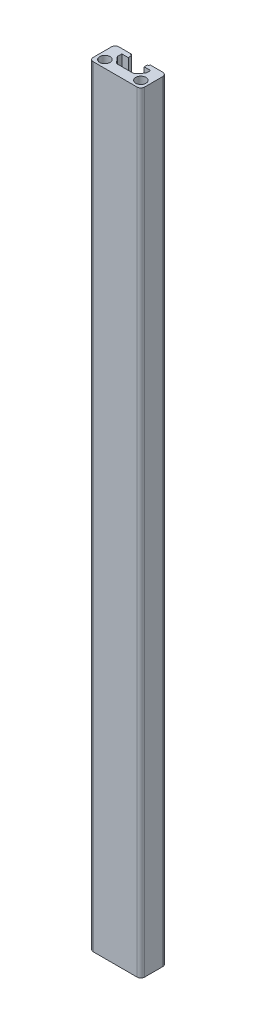
from build123d import *

# Parameters (mm, degrees)
SKETCH_1_R      = 2
EXTRUDE_1_DEPTH = 300
FILLET_1_R      = 1.5


with BuildPart() as part:
    # 草图1 → 凸台-拉伸1 (new body)
    with BuildSketch(Plane(origin=(0, 0, 0), x_dir=(1, 0, 0), z_dir=(0, 1, 0))):
        Polygon((0, 0), (20, 0), (20, 10), (13.65, 10), (13.65, 9.510427602), (13.1, 9.510427602), (13.1, 8.2), (15.6, 8.2), (15.6, 6.447507136), (13.412706863, 3.9), (6.587293137, 3.9), (4.4, 6.447507136), (4.4, 8.2), (6.9, 8.2), (6.9, 9.510427602), (6.35, 9.510427602), (6.35, 10), (0, 10), align=None)
        with Locations(Location((3, 3, 0), (0, 0, 270))):
            Circle(SKETCH_1_R, mode=Mode.SUBTRACT)
        with Locations(Location((17, 3, 0), (0, 0, 270))):
            Circle(SKETCH_1_R, mode=Mode.SUBTRACT)
    extrude(amount=EXTRUDE_1_DEPTH)

    # 圆角1
    fillet_1_edges = [part.edges().sort_by_distance(p)[0] for p in [
        (0, 150, -10),
        (20, 150, -10),
        (20, 150, 0),
        (0, 150, 0),
    ]]
    fillet(fillet_1_edges, radius=FILLET_1_R)


solid = part.part
